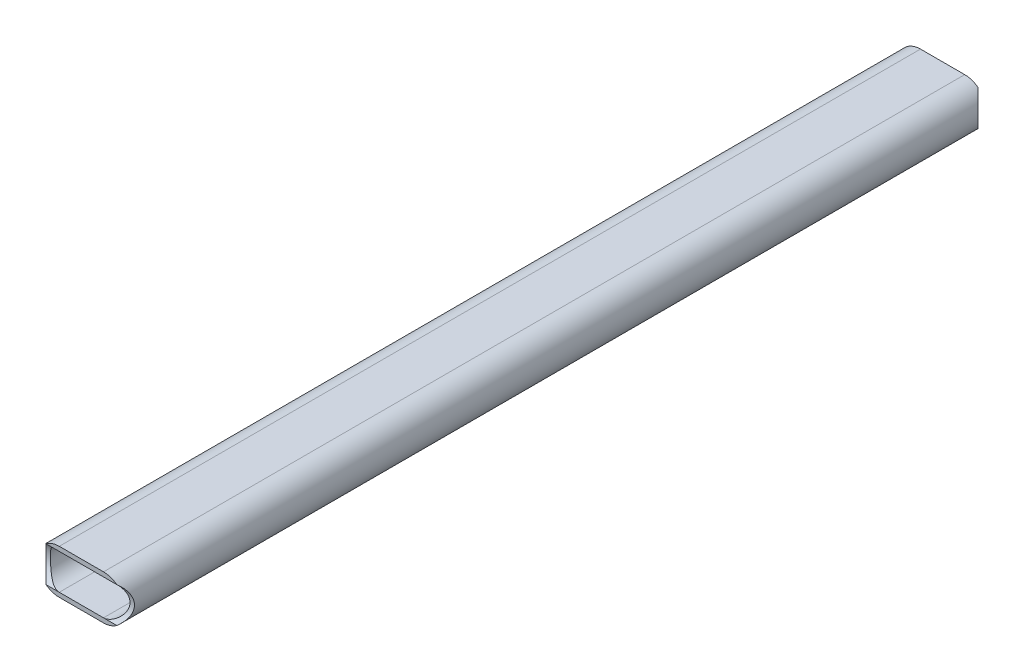
from build123d import *

# Parameters (mm, degrees)
EXTRUDE_1_DEPTH          = 292
CUT_EXTRUDE_1_DEPTH      = 293.961601579
CUT_EXTRUDE_1_DEPTH_BACK = 293.961601579
SKETCH_2_R               = 7.5


with BuildPart() as part:
    # Эскиз1 → Бобышка-Вытянуть1 (new body)
    with BuildSketch(Plane.XY):
        with BuildLine():
            Line((0, 7.5), (15, 7.5))
            ThreePointArc((15, 7.5), (22.5, 0), (15, -7.5))
            Line((15, -7.5), (0, -7.5))
            ThreePointArc((0, -7.5), (-7.5, 0), (0, 7.5))
        make_face()
        with BuildLine():
            Line((0, 6), (15, 6))
            ThreePointArc((15, 6), (21, 0), (15, -6))
            Line((15, -6), (0, -6))
            ThreePointArc((0, -6), (-6, 0), (0, 6))
        make_face(mode=Mode.SUBTRACT)
    extrude(amount=EXTRUDE_1_DEPTH)

    # Эскиз2 → Вырез-Вытянуть1 (cut, two sides: drawn at the far end of the back side and taken through both)
    with BuildSketch(Plane(origin=(0, 0, 0), x_dir=(0, 0, -1), z_dir=(1, 0, 0)).offset(-CUT_EXTRUDE_1_DEPTH_BACK)):
        with Locations((4.5, 0)):
            Circle(SKETCH_2_R)
        with Locations((-296.5, 0)):
            Circle(SKETCH_2_R)
    extrude(amount=CUT_EXTRUDE_1_DEPTH + CUT_EXTRUDE_1_DEPTH_BACK, mode=Mode.SUBTRACT)


solid = part.part
